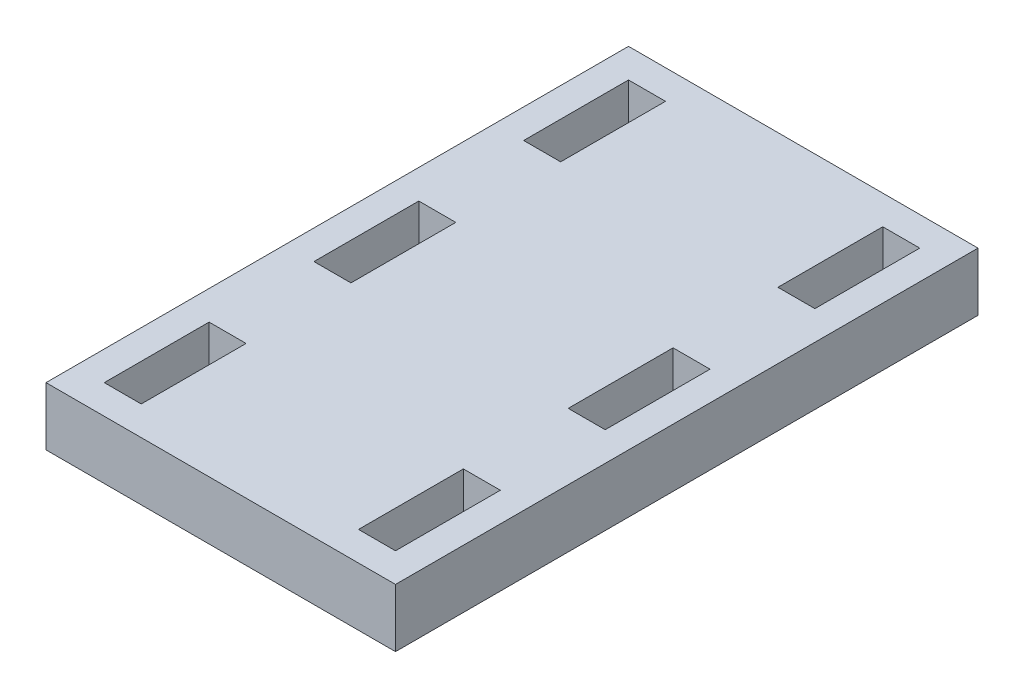
from build123d import *

# Parameters (mm, degrees)
SKETCH2_W           = 60
SKETCH2_H           = 100
BOSS_EXTRUDE1_DEPTH = 10
SKETCH1_W           = 6.35
SKETCH1_H           = 18
CUT_EXTRUDE1_DEPTH  = 10


with BuildPart() as part:
    # Sketch2 → Boss-Extrude1 (new body)
    with BuildSketch(Plane(origin=(0, 0, 0), x_dir=(1, 0, 0), z_dir=(0, 1, 0))):
        with Locations((30, 50)):
            Rectangle(SKETCH2_W, SKETCH2_H)
    extrude(amount=BOSS_EXTRUDE1_DEPTH)

    # Sketch1 → Cut-Extrude1 (cut)
    with BuildSketch(Plane(origin=(0, 0, 0), x_dir=(1, 0, 0), z_dir=(0, 1, 0))):
        with Locations((8.175, 14)):
            Rectangle(SKETCH1_W, SKETCH1_H)
        with Locations((8.175, 50)):
            Rectangle(SKETCH1_W, SKETCH1_H)
        with Locations((8.175, 86)):
            Rectangle(SKETCH1_W, SKETCH1_H)
        with Locations((51.825, 86)):
            Rectangle(SKETCH1_W, SKETCH1_H)
        with Locations((51.825, 50)):
            Rectangle(SKETCH1_W, SKETCH1_H)
        with Locations((51.825, 14)):
            Rectangle(SKETCH1_W, SKETCH1_H)
    extrude(amount=CUT_EXTRUDE1_DEPTH, mode=Mode.SUBTRACT)


solid = part.part
